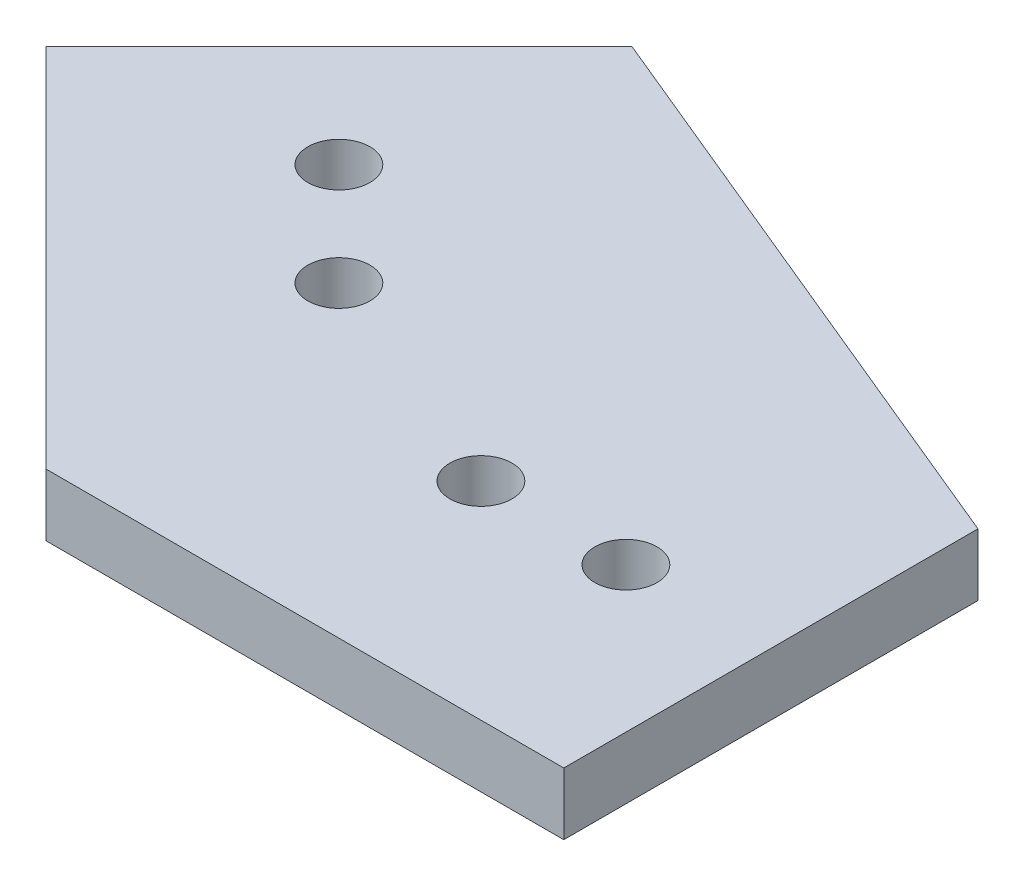
from build123d import *

# Parameters (mm, degrees)
SKETCH1_R           = 1.5
BOSS_EXTRUDE1_DEPTH = 3


with BuildPart() as part:
    # Sketch1 → Boss-Extrude1 (new body)
    with BuildSketch(Plane(origin=(0, 0, 0), x_dir=(1, 0, 0), z_dir=(0, 1, 0))):
        Polygon((0, 0), (25, 0), (25, 20), (-3.535533906, 31.819805153), (-17.67766953, 17.67766953), align=None)
        with Locations(Location((18, 10, 0), (0, 0, 270))):
            Circle(SKETCH1_R, mode=Mode.SUBTRACT)
        with Locations(Location((11, 10, 0), (0, 0, 270))):
            Circle(SKETCH1_R, mode=Mode.SUBTRACT)
        with Locations(Location((-5.656854249, 19.798989873, 0), (0, 0, 90))):
            Circle(SKETCH1_R, mode=Mode.SUBTRACT)
        with Locations(Location((-0.707106781, 14.849242405, 0), (0, 0, 90))):
            Circle(SKETCH1_R, mode=Mode.SUBTRACT)
    extrude(amount=BOSS_EXTRUDE1_DEPTH)


solid = part.part
